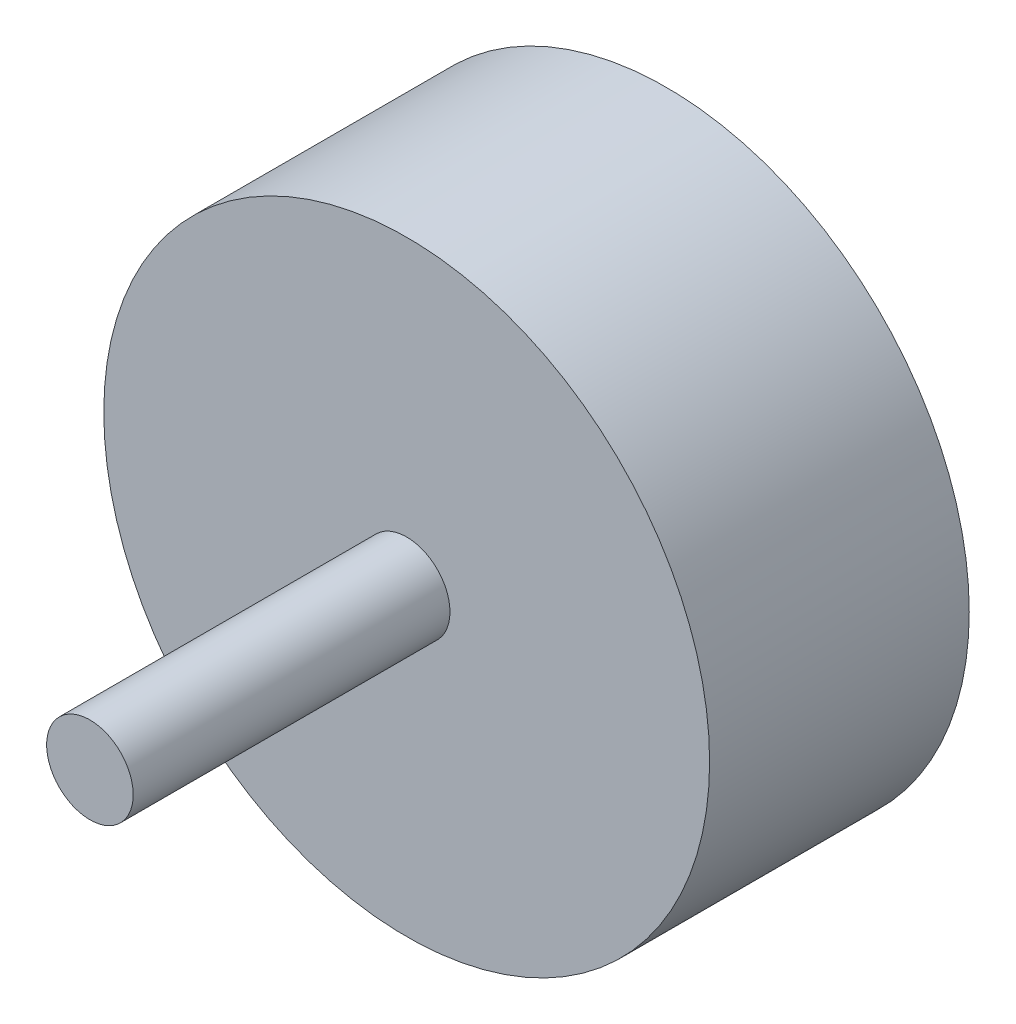
from build123d import *

# Parameters (mm, degrees)
SKETCH1_R           = 88.9
BOSS_EXTRUDE1_DEPTH = 76.2
SKETCH2_R           = 12.7
BOSS_EXTRUDE2_DEPTH = 92.964


with BuildPart() as part:
    # Sketch1 → Boss-Extrude1 (new body)
    with BuildSketch(Plane.XY):
        with Locations(Location((0, 0, 0), (0, 0, 180))):
            Circle(SKETCH1_R)
    extrude(amount=BOSS_EXTRUDE1_DEPTH)

    # Sketch2 → Boss-Extrude2 (add)
    with BuildSketch(Plane.XY.offset(76.2)):
        Circle(SKETCH2_R)
    extrude(amount=BOSS_EXTRUDE2_DEPTH)


solid = part.part
